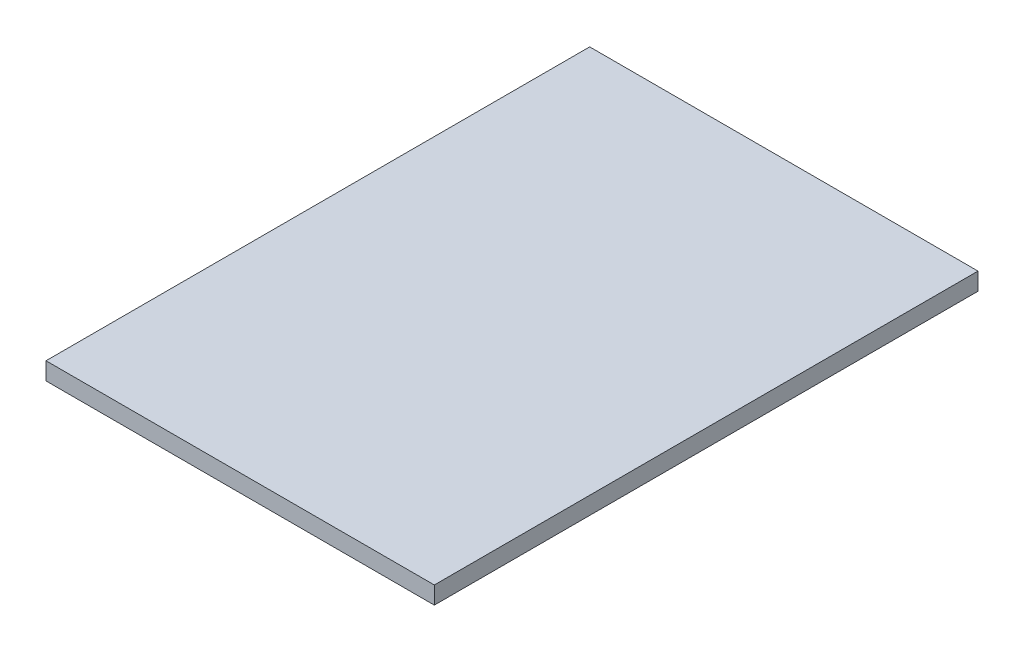
from build123d import *

# Parameters (mm, degrees)
SKETCH1_W           = 20
SKETCH1_H           = 28
BOSS_EXTRUDE1_DEPTH = 0.9


with BuildPart() as part:
    # Sketch1 → Boss-Extrude1 (new body)
    with BuildSketch(Plane(origin=(0, 0, 0), x_dir=(1, 0, 0), z_dir=(0, 1, 0))):
        Rectangle(SKETCH1_W, SKETCH1_H)
    extrude(amount=BOSS_EXTRUDE1_DEPTH)


solid = part.part
